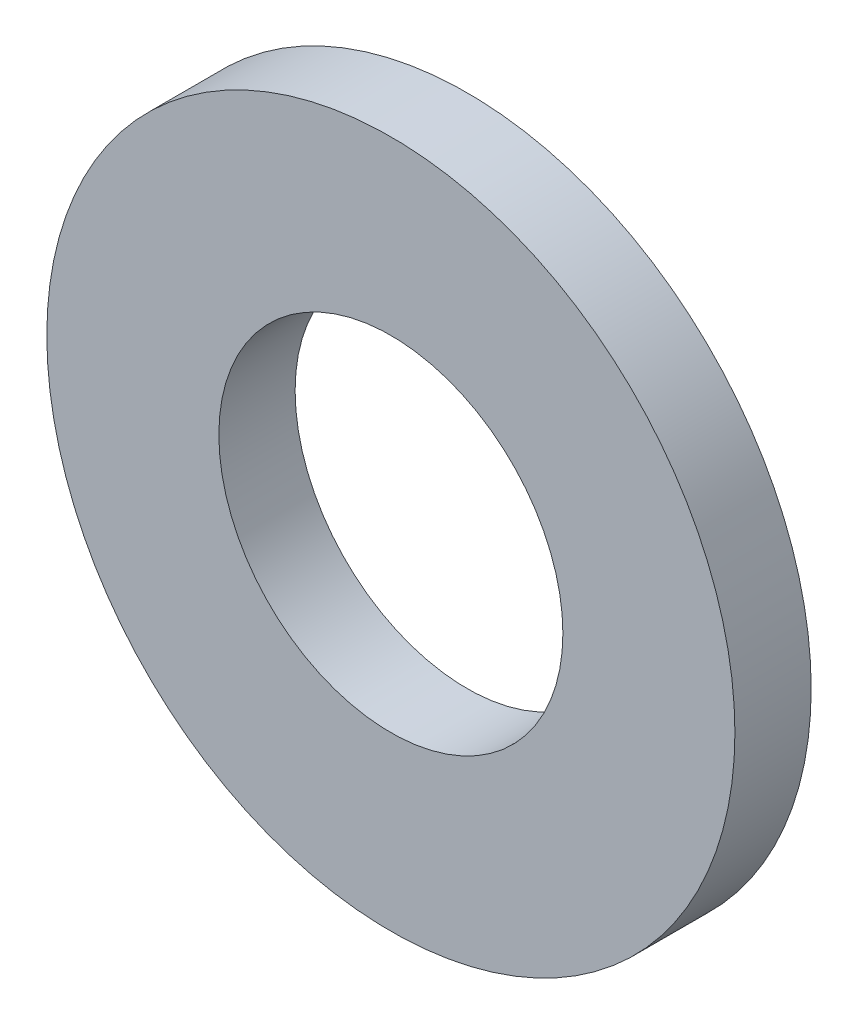
from build123d import *

# Parameters (mm, degrees)
SKETCH1_W = 1.143
SKETCH1_H = 2.5781


with BuildPart() as part:
    # Sketch1 → Revolve1 (revolve)
    with BuildSketch(Plane(origin=(0, 0, 0), x_dir=(0, 0, -1), z_dir=(1, 0, 0)), mode=Mode.PRIVATE) as revolve1_sk:
        with Locations((0.5715, 3.86715)):
            Rectangle(SKETCH1_W, SKETCH1_H)
    revolve(revolve1_sk.sketch.rotate(Axis((0, 0, 0), (0, 0, -1)), 90), axis=Axis((0, 0, 0), (0, 0, -1)))


solid = part.part
